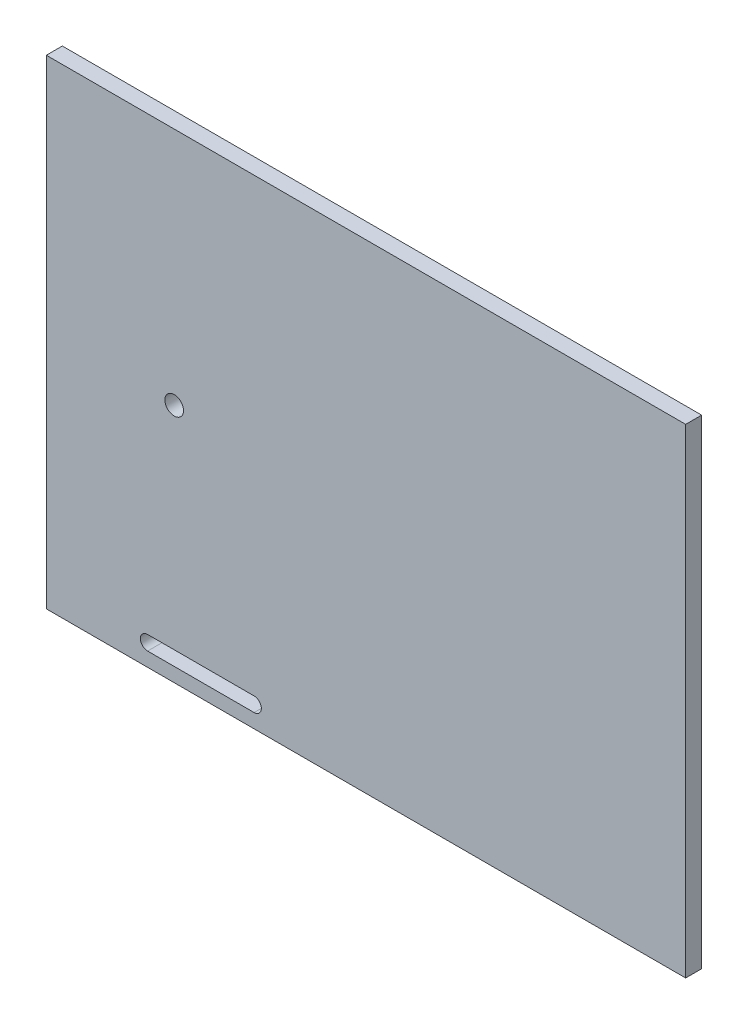
from build123d import *

# Parameters (mm, degrees)
SKETCH1_W           = 120
SKETCH1_H           = 90
BOSS_EXTRUDE1_DEPTH = 3
SKETCH2_R           = 1.75
CUT_EXTRUDE1_DEPTH  = 3
CUT_EXTRUDE2_DEPTH  = 3


with BuildPart() as part:
    # Sketch1 → Boss-Extrude1 (new body)
    with BuildSketch(Plane.XY):
        with Locations((60, -45)):
            Rectangle(SKETCH1_W, SKETCH1_H)
    extrude(amount=BOSS_EXTRUDE1_DEPTH)

    # Sketch2 → Cut-Extrude1 (cut)
    with BuildSketch(Plane.XY.offset(3)):
        with Locations((24, -44.9)):
            Circle(SKETCH2_R)
    extrude(amount=-CUT_EXTRUDE1_DEPTH, mode=Mode.SUBTRACT)

    # Sketch3 → Cut-Extrude2 (cut)
    with BuildSketch(Plane.XY.offset(3)):
        with BuildLine():
            Line((19, -84.65), (39, -84.65))
            ThreePointArc((39, -84.65), (40.35, -86), (39, -87.35))
            Line((39, -87.35), (19, -87.35))
            ThreePointArc((19, -87.35), (17.65, -86), (19, -84.65))
        make_face()
    extrude(amount=-CUT_EXTRUDE2_DEPTH, mode=Mode.SUBTRACT)


solid = part.part
